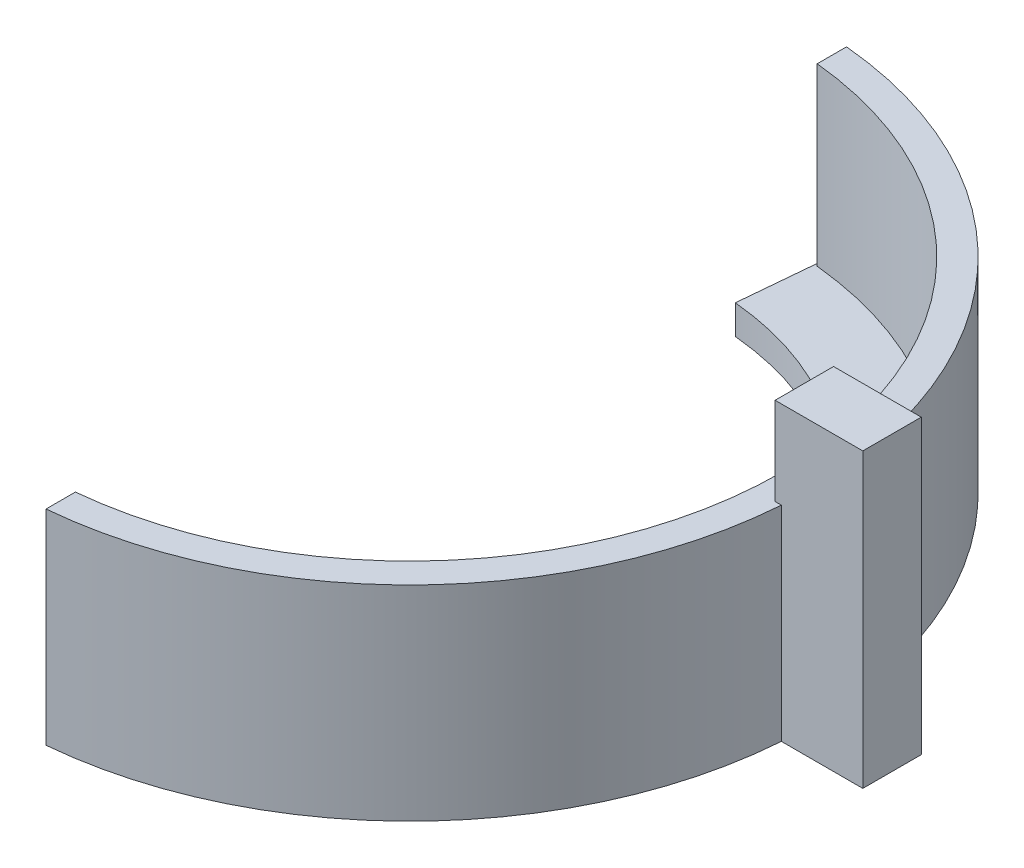
from build123d import *

# Parameters (mm, degrees)
BOSS_EXTRUDE3_DEPTH = 12
BOSS_EXTRUDE4_START = -2
BOSS_EXTRUDE4_DEPTH = 2
SKETCH3_W           = 6
SKETCH3_H           = 4
BOSS_EXTRUDE5_DEPTH = 20


with BuildPart() as part:
    # Sketch1 → Boss-Extrude3 (new body)
    with BuildSketch(Plane(origin=(0, 0, 0), x_dir=(1, 0, 0), z_dir=(0, 1, 0))):
        with BuildLine():
            Line((2.5, 27.386127875), (2.5, 25.377155081))
            ThreePointArc((2.5, 25.377155081), (25.5, 0), (2.5, -25.377155081))
            Line((2.5, -25.377155081), (2.5, -27.386127875))
            ThreePointArc((2.5, -27.386127875), (27.5, 0), (2.5, 27.386127875))
        make_face()
    extrude(amount=BOSS_EXTRUDE3_DEPTH)

    # Sketch2 → Boss-Extrude4 (add)
    with BuildSketch(Plane(origin=(0, 0, 0), x_dir=(1, 0, 0), z_dir=(0, 1, 0)).offset(BOSS_EXTRUDE4_START)):
        with BuildLine():
            Line((2.5, 27.386127875), (1.863636364, 20.415113507))
            ThreePointArc((1.863636364, 20.415113507), (20.5, 0), (1.863636364, -20.415113507))
            Line((1.863636364, -20.415113507), (2.5, -27.386127875))
            ThreePointArc((2.5, -27.386127875), (27.5, 0), (2.5, 27.386127875))
        make_face()
    extrude(amount=BOSS_EXTRUDE4_DEPTH)

    # Sketch3 → Boss-Extrude5 (add)
    with BuildSketch(Plane.XZ.offset(2)):
        with Locations((30, 0)):
            Rectangle(SKETCH3_W, SKETCH3_H)
    extrude(amount=-BOSS_EXTRUDE5_DEPTH)


solid = part.part
